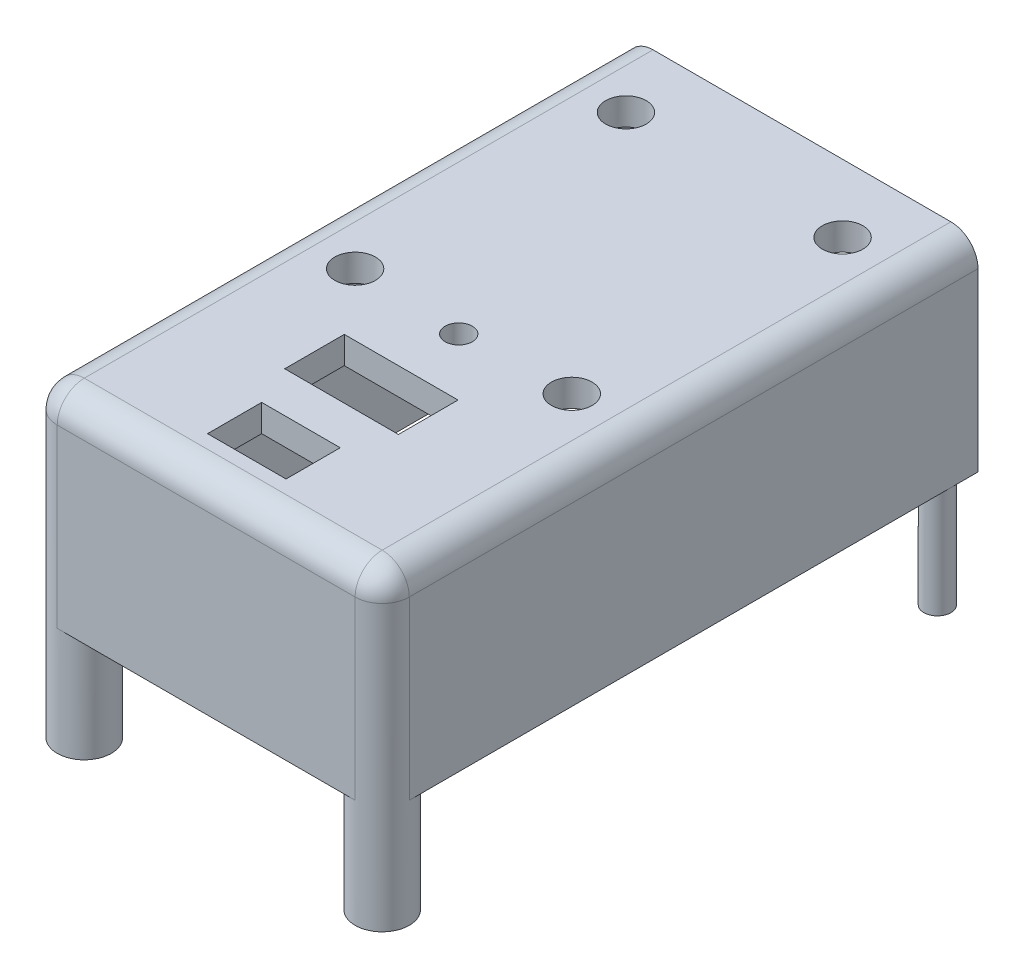
from build123d import *

# Parameters (mm, degrees)
SKETCH1_W                       = 33.02
SKETCH1_H                       = 55.88
BOSS_EXTRUDE1_DEPTH             = 19.05
SHELL2_T                        = -2.54
FILLET2_R                       = 2.54
SKETCH2_R                       = 1.905
CUT_EXTRUDE1_DEPTH              = 2.54
CUT_EXTRUDE2_REACH              = 69.645
SKETCH3_W                       = 10.668
SKETCH3_H                       = 5.588
CUT_EXTRUDE3_REACH              = 69.645
SKETCH4_R                       = 1.27
CUT_EXTRUDE4_REACH              = 69.645
SKETCH5_W                       = 7.366
SKETCH5_H                       = 5.08
BOSS_EXTRUDE2_START             = -16.51
SKETCH6_R                       = 2.54
SKETCH6_R_2                     = 1.27
BOSS_EXTRUDE2_DEPTH             = 26.67
F_49_0_073_DIAMETER_HOLE1_D     = 1.8542
F_49_0_073_DIAMETER_HOLE1_DEPTH = 8.89
F_49_0_073_DIAMETER_HOLE1_TIP   = 0.55705788


with BuildPart() as part:
    # Sketch1 → Boss-Extrude1 (new body)
    with BuildSketch(Plane(origin=(0, 0, 0), x_dir=(1, 0, 0), z_dir=(0, 1, 0))):
        with Locations((16.51, 27.94)):
            Rectangle(SKETCH1_W, SKETCH1_H)
    extrude(amount=BOSS_EXTRUDE1_DEPTH)

    # Shell2
    shell2_openings = [part.faces().sort_by_distance(p)[0] for p in [
        (16.51, 0, -27.94),
        (16.51, 9.525, -55.88),
    ]]
    offset(amount=SHELL2_T, openings=shell2_openings, kind=Kind.INTERSECTION)

    # Fillet2
    fillet2_edges = [part.edges().sort_by_distance(p)[0] for p in [
        (33.02, 19.05, -27.94),
        (0, 19.05, -27.94),
        (16.51, 19.05, 0),
        (33.02, 9.525, 0),
        (0, 9.525, 0),
    ]]
    fillet(fillet2_edges, radius=FILLET2_R)

    # Sketch2 → Cut-Extrude1 (cut)
    with BuildSketch(Plane(origin=(0, 19.05, 0), x_dir=(1, 0, 0), z_dir=(0, 1, 0))):
        with Locations(Location((26.67, 49.53, 0), (0, 0, 270))):
            Circle(SKETCH2_R)
        with Locations(Location((26.67, 24.13, 0), (0, 0, 270))):
            Circle(SKETCH2_R)
        with Locations(Location((6.35, 24.13, 0), (0, 0, 270))):
            Circle(SKETCH2_R)
        with Locations(Location((6.35, 49.53, 0), (0, 0, 270))):
            Circle(SKETCH2_R)
    extrude(amount=-CUT_EXTRUDE1_DEPTH, mode=Mode.SUBTRACT)

    # Sketch3 → Cut-Extrude2 (cut, up to next)
    with BuildSketch(Plane(origin=(0, 19.05, 0), x_dir=(1, 0, 0), z_dir=(0, 1, 0)), mode=Mode.PRIVATE) as cut_extrude2_sk1:
        with Locations((16.51, 15.494)):
            Rectangle(SKETCH3_W, SKETCH3_H)
    cut_extrude2_tool1 = extrude(cut_extrude2_sk1.sketch, amount=-CUT_EXTRUDE2_REACH, mode=Mode.PRIVATE) & part.part
    add(cut_extrude2_tool1.solids().sort_by_distance((16.51, 19.05, -15.494))[0], mode=Mode.SUBTRACT)

    # Sketch4 → Cut-Extrude3 (cut, up to next)
    with BuildSketch(Plane(origin=(0, 19.05, 0), x_dir=(1, 0, 0), z_dir=(0, 1, 0)), mode=Mode.PRIVATE) as cut_extrude3_sk1:
        with Locations(Location((16.51, 23.687982585, 0), (0, 0, 270))):
            Circle(SKETCH4_R)
    cut_extrude3_tool1 = extrude(cut_extrude3_sk1.sketch, amount=-CUT_EXTRUDE3_REACH, mode=Mode.PRIVATE) & part.part
    add(cut_extrude3_tool1.solids().sort_by_distance((16.51, 19.05, -23.687983))[0], mode=Mode.SUBTRACT)

    # Sketch5 → Cut-Extrude4 (cut, up to next)
    with BuildSketch(Plane(origin=(0, 19.05, 0), x_dir=(1, 0, 0), z_dir=(0, 1, 0)), mode=Mode.PRIVATE) as cut_extrude4_sk1:
        with Locations((16.51, 6.35)):
            Rectangle(SKETCH5_W, SKETCH5_H)
    cut_extrude4_tool1 = extrude(cut_extrude4_sk1.sketch, amount=-CUT_EXTRUDE4_REACH, mode=Mode.PRIVATE) & part.part
    add(cut_extrude4_tool1.solids().sort_by_distance((16.51, 19.05, -6.35))[0], mode=Mode.SUBTRACT)

    # Sketch6 → Boss-Extrude2 (add)
    with BuildSketch(Plane(origin=(0, 0, 0), x_dir=(-1, 0, 0), z_dir=(0, -1, 0)).offset(BOSS_EXTRUDE2_START)):
        with Locations(Location((-30.48, 2.54, 0), (0, 0, 90))):
            Circle(SKETCH6_R)
        with Locations(Location((-2.54, 2.54, 0), (0, 0, 90))):
            Circle(SKETCH6_R)
        with Locations(Location((-31.75, 53.34, 0), (0, 0, 90))):
            Circle(SKETCH6_R_2)
        with Locations(Location((-1.27, 53.34, 0), (0, 0, 90))):
            Circle(SKETCH6_R_2)
    extrude(amount=BOSS_EXTRUDE2_DEPTH)

    # #49 (0.073) Diameter Hole1
    with Locations(Plane(origin=(0, 0, -55.88), x_dir=(-1, 0, 0), z_dir=(0, 0, -1))):
        with Locations((-31.75, 15.24), (-31.75, 2.54), (-1.27, 2.54), (-1.27, 15.24)):
            Hole(F_49_0_073_DIAMETER_HOLE1_D / 2, depth=F_49_0_073_DIAMETER_HOLE1_DEPTH)
            with Locations((0, 0, -(F_49_0_073_DIAMETER_HOLE1_DEPTH + F_49_0_073_DIAMETER_HOLE1_TIP / 2))):  # 118° drill point
                Cone(0, F_49_0_073_DIAMETER_HOLE1_D / 2, F_49_0_073_DIAMETER_HOLE1_TIP, mode=Mode.SUBTRACT)


solid = part.part
